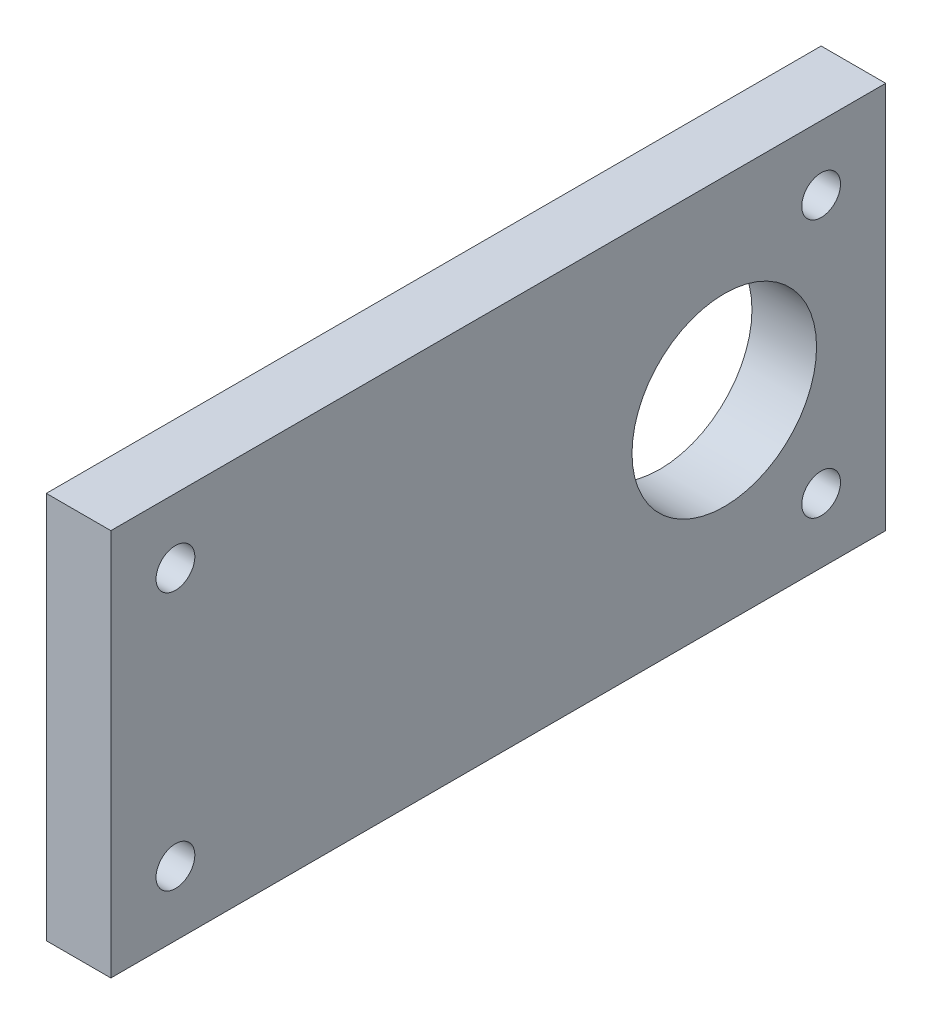
from build123d import *

# Parameters (mm, degrees)
CROQUIS1_W              = 160
CROQUIS1_H              = 60
SALIENTE_EXTRUIR1_DEPTH = 10
CROQUIS2_R              = 14.29
CORTAR_EXTRUIR1_DEPTH   = 87.02325267
CROQUIS3_W              = 40
CROQUIS3_H              = 60
CORTAR_EXTRUIR2_DEPTH   = 87.02325267
CROQUIS4_R              = 3
CORTAR_EXTRUIR3_DEPTH   = 87.02325267


with BuildPart() as part:
    # Croquis1 → Saliente-Extruir1 (new body)
    with BuildSketch(Plane(origin=(0, 0, 0), x_dir=(0, 0, -1), z_dir=(1, 0, 0))):
        Rectangle(CROQUIS1_W, CROQUIS1_H)
    extrude(amount=SALIENTE_EXTRUIR1_DEPTH)

    # Croquis2 → Cortar-Extruir1 (cut, through all)
    with BuildSketch(Plane.ZY):
        with Locations((-58.2308, 0)):
            Circle(CROQUIS2_R)
        with Locations((-15, 0)):
            Circle(CROQUIS2_R)
    extrude(amount=-CORTAR_EXTRUIR1_DEPTH, mode=Mode.SUBTRACT)

    # Croquis3 → Cortar-Extruir2 (cut, through all)
    with BuildSketch(Plane.ZY):
        with Locations((-60, 0)):
            Rectangle(CROQUIS3_W, CROQUIS3_H)
    extrude(amount=-CORTAR_EXTRUIR2_DEPTH, mode=Mode.SUBTRACT)

    # Croquis4 → Cortar-Extruir3 (cut, through all)
    with BuildSketch(Plane.ZY):
        with Locations((70, 20)):
            Circle(CROQUIS4_R)
        with Locations((-30, 20)):
            Circle(CROQUIS4_R)
        with Locations((-30, -20)):
            Circle(CROQUIS4_R)
        with Locations((70, -20)):
            Circle(CROQUIS4_R)
    extrude(amount=-CORTAR_EXTRUIR3_DEPTH, mode=Mode.SUBTRACT)


solid = part.part
